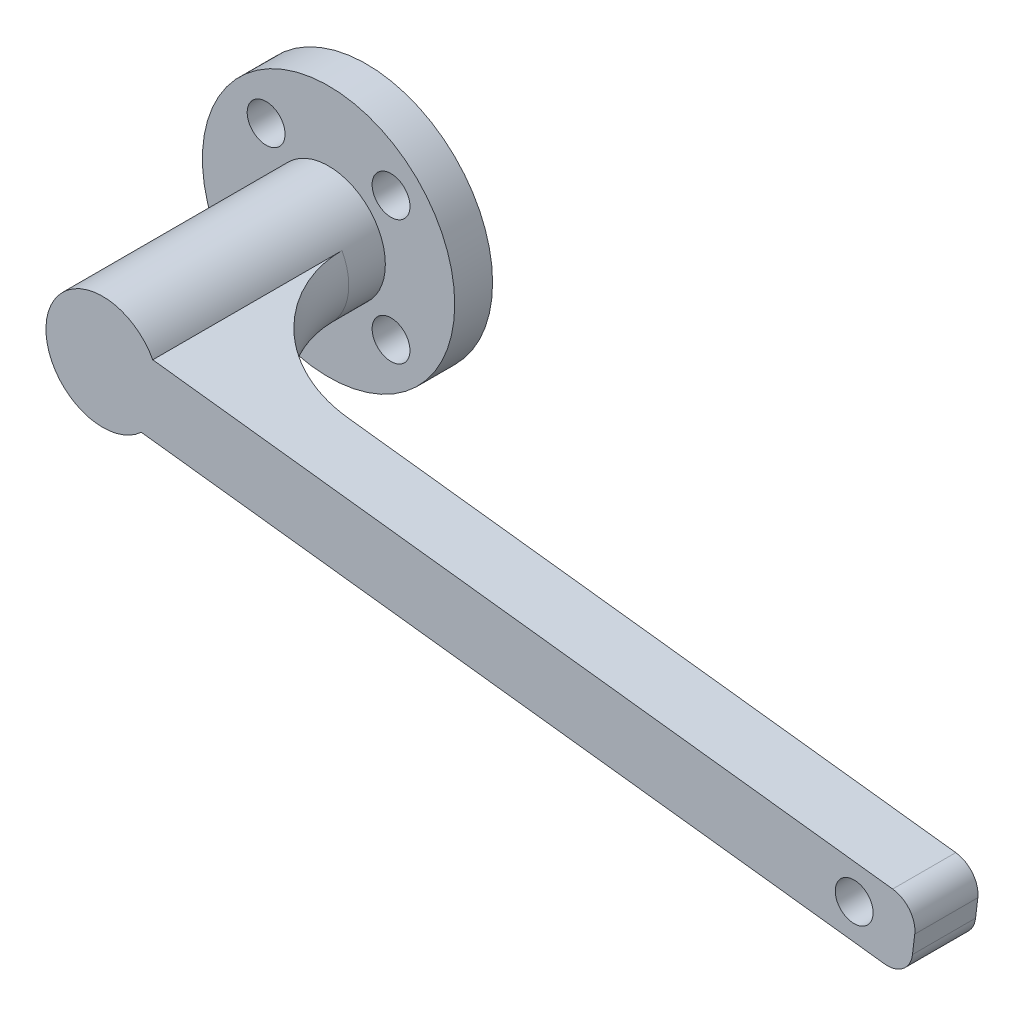
from build123d import *

# Parameters (mm, degrees)
SKETCH_1_R          = 10
EXTRUDE_1_DEPTH     = 3
SKETCH_2_R          = 1.5
CUT_EXTRUDE_1_DEPTH = 15.45683229480096
EXTRUDE_START       = 12.9
SKETCH_3_R          = 4.5
SKETCH_3_R_2        = 1.5000000000000002
EXTRUDE_2_DEPTH     = 12.9
EXTRUDE_START_2     = -15.9
SKETCH_4_R          = 1.5000000000000002
EXTRUDE_4_DEPTH     = 15.9
EXTRUDE_5_DEPTH     = 5
SKETCH_6_R          = 1.4999999999999751
CUT_EXTRUDE_2_DEPTH = 69.71105565006431
EXTRUDE_START_3     = 5
EXTRUDE_8_DEPTH     = 5
FILLET_1_R          = 10
FILLET_2_R          = 2
SKETCH_8_R          = 3.75
CUT_EXTRUDE_3_DEPTH = 3


with BuildPart() as part:
    # 草图1 → 凸台-拉伸1 (new body)
    with BuildSketch(Plane.XY):
        Circle(SKETCH_1_R)
    extrude(amount=EXTRUDE_1_DEPTH)

    # 草图2 → 切除-拉伸1 (cut, through all)
    with BuildSketch(Plane.XY.offset(3)):
        with BuildLine():
            ThreePointArc((-3.4499999999999966, 4.9499999999999975), (-6.010660171779826, 6.010660171779813), (-4.949999999999979, 3.4499999999999966))
            Line((-4.9499999999999975, 3.4499999999999966), (-4.9499999999999975, 4.949999999999997))
            Line((-4.9499999999999975, 4.9499999999999975), (-3.4499999999999957, 4.9499999999999975))
        make_face()
        with BuildLine():
            Line((-4.9499999999999975, 4.949999999999997), (-4.9499999999999975, 3.4499999999999966))
            ThreePointArc((-4.949999999999979, 3.4499999999999966), (-3.8893398282201694, 3.889339828220182), (-3.4499999999999966, 4.9499999999999975))
            Line((-3.4499999999999957, 4.9499999999999975), (-4.9499999999999975, 4.9499999999999975))
        make_face()
        with BuildLine():
            ThreePointArc((3.450000000000002, 4.95), (3.889339828220187, 3.889339828220172), (4.9500000000000215, 3.4499999999999993))
            Line((4.950000000000003, 3.4499999999999984), (4.950000000000003, 4.95))
            Line((4.950000000000003, 4.95), (3.450000000000002, 4.95))
        make_face()
        with BuildLine():
            Line((4.950000000000003, 4.95), (4.950000000000003, 3.4499999999999984))
            ThreePointArc((4.9500000000000215, 3.4499999999999993), (6.010660171779831, 3.8893398282201845), (6.450000000000004, 4.95))
            ThreePointArc((6.450000000000004, 4.95), (4.950000000000003, 6.450000000000001), (3.450000000000002, 4.95))
            Line((3.450000000000002, 4.95), (4.950000000000003, 4.95))
        make_face()
        with BuildLine():
            ThreePointArc((-4.949999999999978, -3.450000000000001), (-6.0106601717798265, -6.010660171779817), (-3.4499999999999966, -4.950000000000002))
            Line((-3.4499999999999957, -4.950000000000002), (-4.9499999999999975, -4.950000000000002))
            Line((-4.9499999999999975, -4.950000000000002), (-4.9499999999999975, -3.450000000000001))
        make_face()
        with BuildLine():
            Line((-4.9499999999999975, -4.950000000000002), (-3.4499999999999957, -4.950000000000002))
            ThreePointArc((-3.4499999999999966, -4.950000000000002), (-3.8893398282201685, -3.889339828220187), (-4.949999999999978, -3.450000000000001))
            Line((-4.9499999999999975, -3.450000000000001), (-4.9499999999999975, -4.950000000000002))
        make_face()
        with BuildLine():
            ThreePointArc((4.950000000000022, -3.4499999999999993), (3.889339828220188, -3.8893398282201717), (3.450000000000002, -4.95))
            Line((3.450000000000002, -4.95), (4.950000000000003, -4.95))
            Line((4.950000000000003, -4.95), (4.950000000000003, -3.4499999999999993))
        make_face()
        with BuildLine():
            Line((4.950000000000003, -4.95), (3.450000000000002, -4.95))
            ThreePointArc((3.450000000000002, -4.95), (4.950000000000003, -6.450000000000001), (6.450000000000004, -4.95))
            ThreePointArc((6.450000000000004, -4.95), (6.010660171779832, -3.8893398282201854), (4.950000000000022, -3.4499999999999993))
            Line((4.950000000000003, -3.4499999999999993), (4.950000000000003, -4.95))
        make_face()
        Circle(SKETCH_2_R)
    extrude(amount=-CUT_EXTRUDE_1_DEPTH, mode=Mode.SUBTRACT)

    # 草图3 → 凸台-拉伸2 (add)
    with BuildSketch(Plane.XY.offset(3).offset(EXTRUDE_START)):
        with Locations(Location((0, 0, 0), (0, 0, 180))):
            Circle(SKETCH_3_R)
        Circle(SKETCH_3_R_2, mode=Mode.SUBTRACT)
    extrude(amount=-EXTRUDE_2_DEPTH)

    # 草图4 → 凸台-拉伸4 (add)
    with BuildSketch(Plane(origin=(0, 0, 0), x_dir=(-1, 0, 0), z_dir=(0, 0, -1)).offset(EXTRUDE_START_2)):
        Circle(SKETCH_4_R)
    extrude(amount=EXTRUDE_4_DEPTH)

    # 草图5 → 凸台-拉伸5 (add)
    with BuildSketch(Plane.XY.offset(15.9)):
        Polygon((64.59529016246847, -5.1146065812479), (63.94313316774814, -10.575805282470675), (-0.5983060285210257, -2.8684953448666564), (0.05385096619931135, 2.5927033563560817), align=None)
    extrude(amount=EXTRUDE_5_DEPTH)

    # 草图6 → 切除-拉伸2 (cut, through all)
    with BuildSketch(Plane.XY.offset(20.900000000000002)):
        with Locations((59.55641321806875, -7.28242024320529)):
            Circle(SKETCH_6_R)
    extrude(amount=-CUT_EXTRUDE_2_DEPTH, mode=Mode.SUBTRACT)

    # 草图7 → 凸台-拉伸8 (add)
    with BuildSketch(Plane.XY.offset(15.9).offset(EXTRUDE_START_3)):
        with BuildLine():
            Line((0.05385096619931135, 2.5927033563560817), (3.9664004294167037, 2.1254805653129325))
            ThreePointArc((3.9664004294167037, 2.1254805653129325), (-4.4378387444626375, 0.7453772723569406), (3.054352769395848, -3.3046829136974565))
            Line((3.054352769395848, -3.3046829136974565), (-0.5983060285210257, -2.8684953448666564))
            Line((-0.5983060285210257, -2.8684953448666564), (0.05385096619931135, 2.5927033563560817))
        make_face()
    extrude(amount=-EXTRUDE_8_DEPTH)

    # 圆角1
    fillet_1_edges = [part.edges().sort_by_distance(p)[0] for p in [
        (4.437838744462656, -0.7453772723568349, 15.9),
    ]]
    fillet(fillet_1_edges, radius=FILLET_1_R)

    # 圆角2
    fillet_2_edges = [part.edges().sort_by_distance(p)[0] for p in [
        (63.94313316774814, -10.575805282470675, 18.4),
        (64.59529016246847, -5.1146065812479, 18.4),
    ]]
    fillet(fillet_2_edges, radius=FILLET_2_R)

    # 草图8 → 切除-拉伸3 (cut)
    with BuildSketch(Plane(origin=(0, 0, 0), x_dir=(-1, 0, 0), z_dir=(0, 0, -1))):
        Circle(SKETCH_8_R)
    extrude(amount=-CUT_EXTRUDE_3_DEPTH, mode=Mode.SUBTRACT)


solid = part.part
